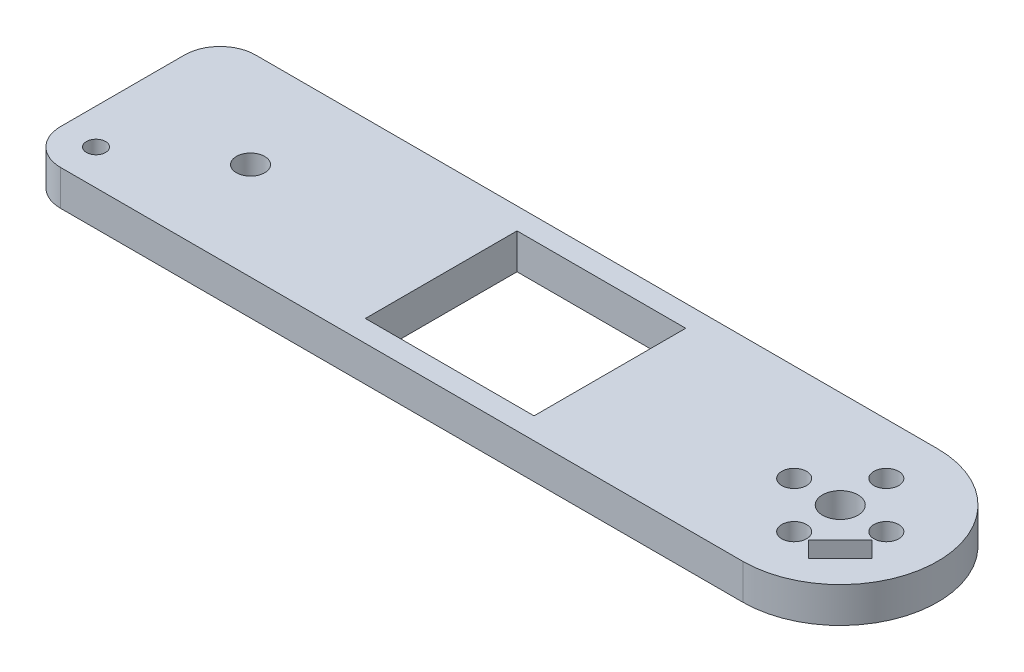
from build123d import *

# Parameters (mm, degrees)
SKETCH1_W            = 175
SKETCH1_H            = 55
BOSS_EXTRUDE1_DEPTH  = 10
SKETCH2_W            = 27.5
SKETCH2_H            = 55
BOSS_EXTRUDE2_DEPTH  = 10
M8_CLEARANCE_HOLE1_D = 10
M6_CLEARANCE_HOLE1_D = 7
FILLET1_R            = 10
SKETCH11_W           = 42.4
SKETCH11_H           = 42.4
CUT_EXTRUDE3_DEPTH   = 119.664442863
SKETCH12_R           = 4
CUT_EXTRUDE4_DEPTH   = 119.664442863
SKETCH13_W           = 5
SKETCH13_H           = 42.4
CUT_EXTRUDE5_DEPTH   = 119.664442863
CUT_EXTRUDE6_DEPTH   = 12.7
SKETCH16_R           = 2.7
CUT_EXTRUDE8_DEPTH   = 119.664442863


with BuildPart() as part:
    # Sketch1 → Boss-Extrude1 (new body)
    with BuildSketch(Plane(origin=(0, 0, 0), x_dir=(1, 0, 0), z_dir=(0, 1, 0))):
        Rectangle(SKETCH1_W, SKETCH1_H)
    extrude(amount=BOSS_EXTRUDE1_DEPTH)

    # Sketch2 → Boss-Extrude2 (add)
    with BuildSketch(Plane.XZ):
        with Locations((-101.25, 0)):
            Rectangle(SKETCH2_W, SKETCH2_H)
        with BuildLine():
            Line((87.5, 27.5), (87.5, -27.5))
            ThreePointArc((87.5, -27.5), (115, 0), (87.5, 27.5))
        make_face()
    extrude(amount=-BOSS_EXTRUDE2_DEPTH)

    # M8 Clearance Hole1 (through all)
    with Locations(Plane(origin=(0, 0, 0), x_dir=(-1, 0, 0), z_dir=(0, -1, 0))):
        with Locations((-87.5, 0)):
            Hole(M8_CLEARANCE_HOLE1_D / 2)

    # M6 Clearance Hole1 (through all)
    with Locations(Plane(origin=(0, 10, 0), x_dir=(1, 0, 0), z_dir=(0, 1, 0))):
        with Locations((87.5, 13), (74.5, 0), (100.5, 0), (87.5, -13)):
            Hole(M6_CLEARANCE_HOLE1_D / 2)

    # Fillet1
    fillet1_edges = [part.edges().sort_by_distance(p)[0] for p in [
        (-115, 5, -27.5),
        (-115, 5, 27.5),
    ]]
    fillet(fillet1_edges, radius=FILLET1_R)

    # Sketch11 → Cut-Extrude3 (cut, through all)
    with BuildSketch(Plane.XZ):
        with Locations((-3.7, 0)):
            Rectangle(SKETCH11_W, SKETCH11_H)
    extrude(amount=-CUT_EXTRUDE3_DEPTH, mode=Mode.SUBTRACT)

    # Sketch12 → Cut-Extrude4 (cut, through all)
    with BuildSketch(Plane.XZ):
        with Locations(Location((-78.9, 0, 0), (0, 0, 270))):
            Circle(SKETCH12_R)
    extrude(amount=-CUT_EXTRUDE4_DEPTH, mode=Mode.SUBTRACT)

    # Sketch13 → Cut-Extrude5 (cut, through all)
    with BuildSketch(Plane.XZ):
        Polygon((-25.1, -21.4), (-25.1, 21.4), (-24.9, 21.4), (-24.9, 21.2), (-24.9, -21.2), (-24.9, -21.4), align=None)
        Polygon((17.5, 21.2), (22.5, 21.2), (22.5, 21.4), (-24.9, 21.4), (-24.9, 21.2), align=None)
        with Locations((20, 0)):
            Rectangle(SKETCH13_W, SKETCH13_H)
        Polygon((-24.9, -21.2), (-24.9, -21.4), (22.5, -21.4), (22.5, -21.2), (17.5, -21.2), align=None)
    extrude(amount=-CUT_EXTRUDE5_DEPTH, mode=Mode.SUBTRACT)

    # Sketch14 → Cut-Extrude6 (cut)
    with BuildSketch(Plane.XZ):
        Polygon((91.541115254, 13.021371376), (100.521371376, 4.041115254), (105.011499436, 8.531243315), (96.031243315, 17.511499436), align=None)
    extrude(amount=-CUT_EXTRUDE6_DEPTH, mode=Mode.SUBTRACT)

    # Sketch16 → Cut-Extrude8 (cut, through all)
    with BuildSketch(Plane.XZ):
        with Locations(Location((-105, 17.5, 0), (0, 0, 270))):
            Circle(SKETCH16_R)
    extrude(amount=-CUT_EXTRUDE8_DEPTH, mode=Mode.SUBTRACT)


solid = part.part
